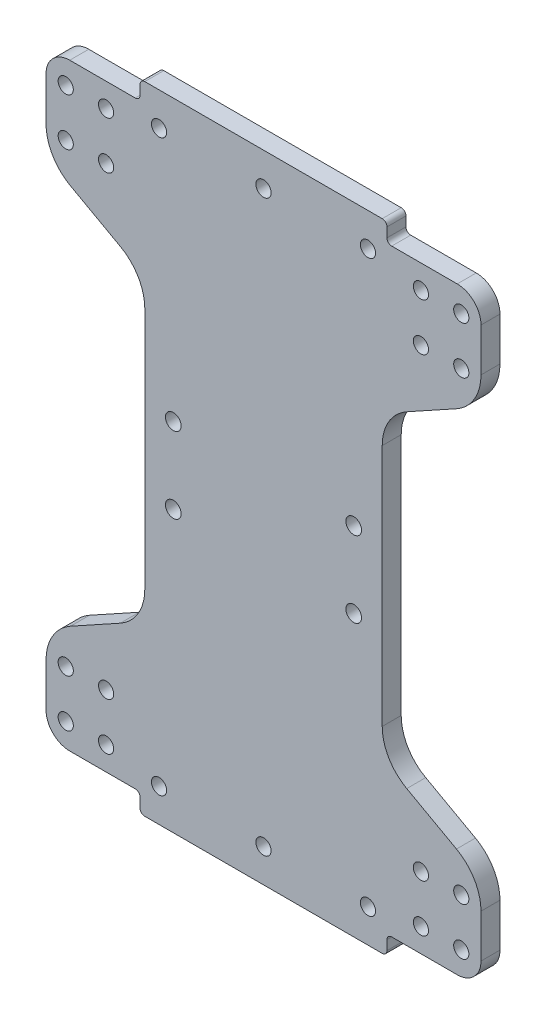
from build123d import *

# Parameters (mm, degrees)
SKETCH1_R           = 1.6
SKETCH1_R_2         = 1.65
BOSS_EXTRUDE1_DEPTH = 4
FILLET2_R           = 10
FILLET3_R           = 5


with BuildPart() as part:
    # Sketch1 → Boss-Extrude1 (new body)
    with BuildSketch(Plane.XY):
        with BuildLine():
            Line((1.40773023, -0.063608297), (20.206941284, -0.063608297))
            ThreePointArc((20.206941284, -0.063608297), (20.914048066, -0.356501516), (21.206941284, -1.063608297))
            Line((21.206941284, -1.063608297), (21.206941284, -3.063608297))
            ThreePointArc((21.206941284, -3.063608297), (21.499834503, -3.770715079), (22.206941284, -4.063608297))
            Line((22.206941284, -4.063608297), (72.208519176, -4.063608297))
            ThreePointArc((72.208519176, -4.063608297), (72.915625957, -3.770715079), (73.208519176, -3.063608297))
            Line((73.208519176, -3.063608297), (73.208519176, -1.063608297))
            ThreePointArc((73.208519176, -1.063608297), (73.501412395, -0.356501516), (74.208519176, -0.063608297))
            Line((74.208519176, -0.063608297), (93.00773023, -0.063608297))
            Line((93.00773023, -0.063608297), (93.00773023, 19.936391703))
            Line((93.00773023, 19.936391703), (72.20773023, 31.430017028))
            Line((72.20773023, 31.430017028), (72.20773023, 94.442766377))
            Line((72.20773023, 94.442766377), (93.00773023, 105.936391703))
            Line((93.00773023, 105.936391703), (93.00773023, 125.936391703))
            Line((93.00773023, 125.936391703), (74.208519176, 125.936391703))
            ThreePointArc((74.208519176, 125.936391703), (73.501412395, 126.229284921), (73.208519176, 126.936391703))
            Line((73.208519176, 126.936391703), (73.208519176, 128.936391703))
            ThreePointArc((73.208519176, 128.936391703), (72.915625957, 129.643498484), (72.208519176, 129.936391703))
            Line((72.208519176, 129.936391703), (22.206941284, 129.936391703))
            ThreePointArc((22.206941284, 129.936391703), (21.499834503, 129.643498484), (21.206941284, 128.936391703))
            Line((21.206941284, 128.936391703), (21.206941284, 126.936391703))
            ThreePointArc((21.206941284, 126.936391703), (20.914048066, 126.229284921), (20.206941284, 125.936391703))
            Line((20.206941284, 125.936391703), (1.40773023, 125.936391703))
            Line((1.40773023, 125.936391703), (1.40773023, 105.936391703))
            Line((1.40773023, 105.936391703), (22.20773023, 94.442766377))
            Line((22.20773023, 94.442766377), (22.20773023, 31.430017028))
            Line((22.20773023, 31.430017028), (1.40773023, 19.936391703))
            Line((1.40773023, 19.936391703), (1.40773023, -0.063608297))
        make_face()
        with Locations((5.55773023, 4.936391703)):
            Circle(SKETCH1_R, mode=Mode.SUBTRACT)
        with Locations((14.05773023, 4.936391703)):
            Circle(SKETCH1_R, mode=Mode.SUBTRACT)
        with Locations((14.05773023, 14.936391703)):
            Circle(SKETCH1_R, mode=Mode.SUBTRACT)
        with Locations((5.55773023, 14.936391703)):
            Circle(SKETCH1_R, mode=Mode.SUBTRACT)
        with Locations(Location((69.208519176, 2.936391703, 0), (0, 0, 180))):
            Circle(SKETCH1_R, mode=Mode.SUBTRACT)
        with Locations((47.206941284, 2.936391703)):
            Circle(SKETCH1_R, mode=Mode.SUBTRACT)
        with Locations(Location((66.20773023, 54.936391703, 0), (0, 0, 180))):
            Circle(SKETCH1_R_2, mode=Mode.SUBTRACT)
        with Locations(Location((88.85773023, 14.936391703, 0), (0, 0, 180))):
            Circle(SKETCH1_R, mode=Mode.SUBTRACT)
        with Locations(Location((80.35773023, 14.936391703, 0), (0, 0, 180))):
            Circle(SKETCH1_R, mode=Mode.SUBTRACT)
        with Locations(Location((80.35773023, 4.936391703, 0), (0, 0, 180))):
            Circle(SKETCH1_R, mode=Mode.SUBTRACT)
        with Locations(Location((88.85773023, 4.936391703, 0), (0, 0, 180))):
            Circle(SKETCH1_R, mode=Mode.SUBTRACT)
        with Locations((28.20773023, 54.936391703)):
            Circle(SKETCH1_R_2, mode=Mode.SUBTRACT)
        with Locations((25.206941284, 2.936391703)):
            Circle(SKETCH1_R, mode=Mode.SUBTRACT)
        with Locations(Location((25.206941284, 122.936391703, 0), (0, 0, 180))):
            Circle(SKETCH1_R, mode=Mode.SUBTRACT)
        with Locations(Location((28.20773023, 70.936391703, 0), (0, 0, 180))):
            Circle(SKETCH1_R_2, mode=Mode.SUBTRACT)
        with Locations((88.85773023, 120.936391703)):
            Circle(SKETCH1_R, mode=Mode.SUBTRACT)
        with Locations((80.35773023, 120.936391703)):
            Circle(SKETCH1_R, mode=Mode.SUBTRACT)
        with Locations((80.35773023, 110.936391703)):
            Circle(SKETCH1_R, mode=Mode.SUBTRACT)
        with Locations((88.85773023, 110.936391703)):
            Circle(SKETCH1_R, mode=Mode.SUBTRACT)
        with Locations((66.20773023, 70.936391703)):
            Circle(SKETCH1_R_2, mode=Mode.SUBTRACT)
        with Locations(Location((47.206941284, 122.936391703, 0), (0, 0, 180))):
            Circle(SKETCH1_R, mode=Mode.SUBTRACT)
        with Locations((69.208519176, 122.936391703)):
            Circle(SKETCH1_R, mode=Mode.SUBTRACT)
        with Locations(Location((5.55773023, 110.936391703, 0), (0, 0, 180))):
            Circle(SKETCH1_R, mode=Mode.SUBTRACT)
        with Locations(Location((14.05773023, 110.936391703, 0), (0, 0, 180))):
            Circle(SKETCH1_R, mode=Mode.SUBTRACT)
        with Locations(Location((14.05773023, 120.936391703, 0), (0, 0, 180))):
            Circle(SKETCH1_R, mode=Mode.SUBTRACT)
        with Locations(Location((5.55773023, 120.936391703, 0), (0, 0, 180))):
            Circle(SKETCH1_R, mode=Mode.SUBTRACT)
    extrude(amount=BOSS_EXTRUDE1_DEPTH)

    # Fillet2
    fillet2_edges = [part.edges().sort_by_distance(p)[0] for p in [
        (1.40773023, 19.936391703, 2),
        (22.20773023, 31.430017028, 2),
        (22.20773023, 94.442766377, 2),
        (1.40773023, 105.936391703, 2),
        (93.00773023, 105.936391703, 2),
        (72.20773023, 94.442766377, 2),
        (72.20773023, 31.430017028, 2),
        (93.00773023, 19.936391703, 2),
    ]]
    fillet(fillet2_edges, radius=FILLET2_R)

    # Fillet3
    fillet3_edges = [part.edges().sort_by_distance(p)[0] for p in [
        (1.40773023, 125.936391703, 2),
        (93.00773023, 125.936391703, 2),
        (93.00773023, -0.063608297, 2),
        (1.40773023, -0.063608297, 2),
    ]]
    fillet(fillet3_edges, radius=FILLET3_R)


solid = part.part
